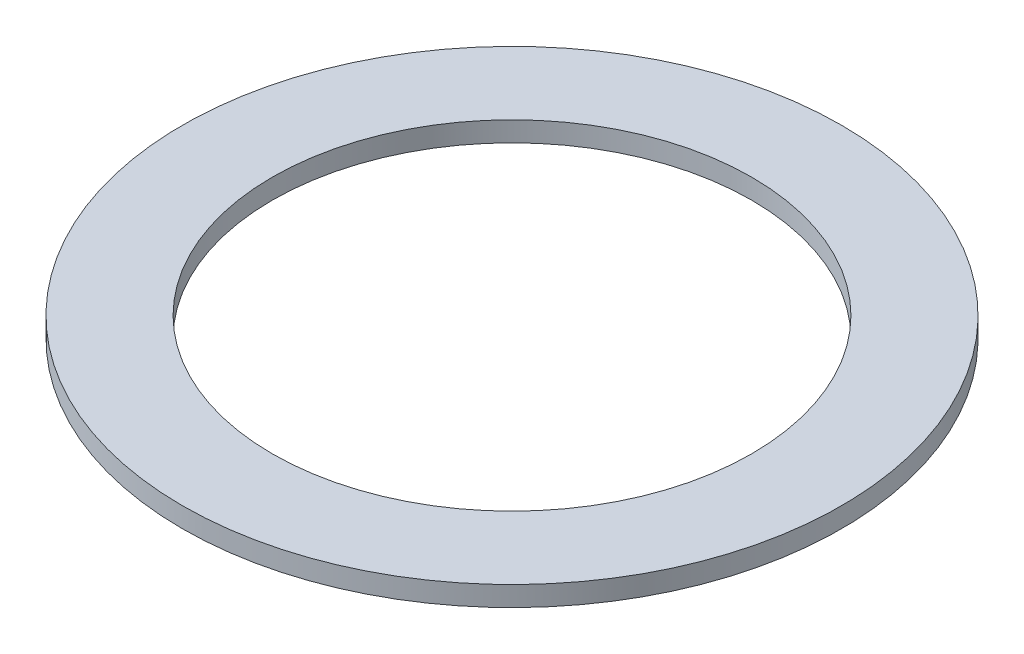
from build123d import *

# Parameters (mm, degrees)
SKETCH2_R           = 16.5
SKETCH2_R_2         = 12
BOSS_EXTRUDE1_DEPTH = 1


with BuildPart() as part:
    # Sketch2 → Boss-Extrude1 (new body)
    with BuildSketch(Plane(origin=(0, 0, 0), x_dir=(1, 0, 0), z_dir=(0, 1, 0))):
        with Locations(Location((0, 0, 0), (0, 0, 270))):
            Circle(SKETCH2_R)
        with Locations(Location((0, 0, 0), (0, 0, 270))):
            Circle(SKETCH2_R_2, mode=Mode.SUBTRACT)
    extrude(amount=BOSS_EXTRUDE1_DEPTH)


solid = part.part
